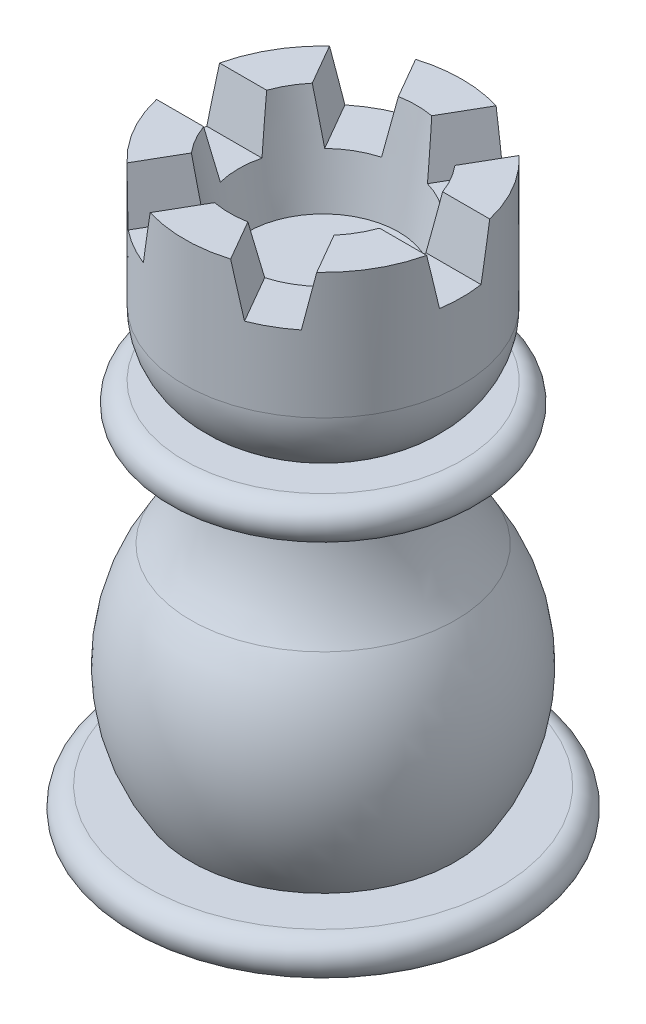
from build123d import *

# Parameters (mm, degrees)
CUT_EXTRUDE2_DEPTH = 51.955863315
CIRPATTERN2_COUNT  = 3


with BuildPart() as part:
    # Sketch1 → Revolve1 (revolve)
    with BuildSketch(Plane(origin=(0, 0, 0), x_dir=(0, 0, -1), z_dir=(1, 0, 0))):
        with BuildLine():
            Line((6, 38), (0, 38))
            Line((0, 38), (0, 0))
            Line((0, 0), (14, 0))
            ThreePointArc((14, 0), (15.5, 1.5), (14, 3))
            Line((14, 3), (10.5, 3))
            ThreePointArc((10.5, 3), (13, 11.291638169), (10.499915764, 19.583250941))
            ThreePointArc((10.499915764, 19.583250941), (8.648748728, 23.510719191), (8, 27.803847577))
            Line((8, 27.803847577), (11, 27.803847577))
            ThreePointArc((11, 27.803847577), (12.5, 29.303847577), (11, 30.803847577))
            Line((11, 30.803847577), (8, 30.803847577))
            ThreePointArc((8, 30.803847577), (10.196152423, 33), (11, 36))
            Line((11, 36), (11, 46))
            Line((11, 46), (7.410615846, 46))
            Line((7.410615846, 46), (6, 38))
        make_face()
    revolve(axis=Axis((0, 0, 0), (0, 1, 0)))

    # Sketch3 → Cut-Extrude2 (cut, symmetric)
    with BuildSketch(Plane(origin=(0, 0, 0), x_dir=(0, 0, -1), z_dir=(1, 0, 0))):
        Polygon((-2.5, 46), (2.5, 46), (1.649773753, 42), (-1.649773753, 42), align=None)
    cut_extrude2 = extrude(amount=CUT_EXTRUDE2_DEPTH, both=True, mode=Mode.SUBTRACT)

    # CirPattern2: Cut-Extrude2 ×3 about axis
    cirpattern2_axis = Axis((0, 0, 0), (0, 1, 0))
    for i in range(1, CIRPATTERN2_COUNT):
        add(cut_extrude2.rotate(cirpattern2_axis, i * 360 / CIRPATTERN2_COUNT), mode=Mode.SUBTRACT)


solid = part.part
